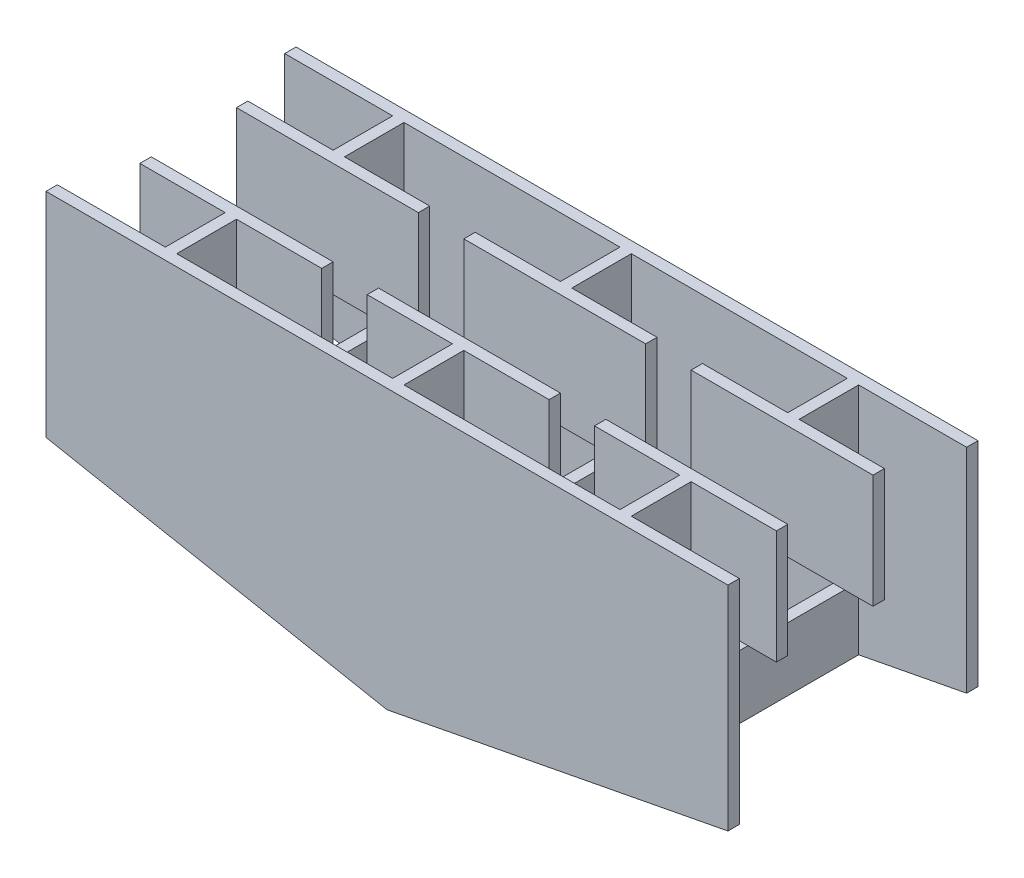
from build123d import *

# Parameters (mm, degrees)
BOSS_EXTRUDE1_DEPTH     = 111.76
SKETCH5_W               = 304.8
SKETCH5_H               = 25.4
CUT_EXTRUDE3_DEPTH      = 101.6
CUT_EXTRUDE4_DEPTH      = 227.288199427
CUT_EXTRUDE4_DEPTH_BACK = 227.288199427
SKETCH3_W               = 96.52
SKETCH3_H               = 101.6
SKETCH3_W_2             = 48.26
CUT_EXTRUDE5_REACH      = 288.663
SKETCH6_W               = 38.1
SKETCH6_H               = 50.8
SKETCH7_W               = 81.28
SKETCH7_H               = 50.8
BOSS_EXTRUDE2_DEPTH     = 5.08


with BuildPart() as part:
    # Sketch1 → Boss-Extrude1 (new body)
    with BuildSketch(Plane.XY):
        Polygon((-152.4, 62.23), (-152.4, -33.02), (0, -62.23), (152.4, -32.976439839), (152.4, 62.23), align=None)
    extrude(amount=-BOSS_EXTRUDE1_DEPTH)

    # Sketch5 → Cut-Extrude3 (cut)
    with BuildSketch(Plane.XY.offset(-5.08)):
        with Locations((0, -1.27)):
            Rectangle(SKETCH5_W, SKETCH5_H)
    extrude(amount=-CUT_EXTRUDE3_DEPTH, mode=Mode.SUBTRACT)

    # Sketch3 → Cut-Extrude4 (cut, two sides: drawn at the far end of the back side and taken through both)
    with BuildSketch(Plane(origin=(0, 62.23, 0), x_dir=(1, 0, 0), z_dir=(0, 1, 0)).offset(-CUT_EXTRUDE4_DEPTH_BACK)):
        with Locations((-50.8, 55.88)):
            Rectangle(SKETCH3_W, SKETCH3_H)
        with Locations((50.8, 55.88)):
            Rectangle(SKETCH3_W, SKETCH3_H)
        with Locations((-128.27, 55.88)):
            Rectangle(SKETCH3_W_2, SKETCH3_H)
        with Locations((128.27, 55.88)):
            Rectangle(SKETCH3_W_2, SKETCH3_H)
    extrude(amount=CUT_EXTRUDE4_DEPTH + CUT_EXTRUDE4_DEPTH_BACK, mode=Mode.SUBTRACT)

    # Cut-Extrude5: up to this face of the body (flat: up to its plane)
    cut_extrude5_end = Plane(part.part.faces().sort_by_distance((104.14, 36.83, -55.88))[0])
    # Sketch6 → Cut-Extrude5 (cut, up to the picked face)
    with BuildSketch(Plane.ZY.offset(104.14), mode=Mode.PRIVATE) as cut_extrude5_sk1:
        with Locations((-55.932057734, 36.83)):
            Rectangle(SKETCH6_W, SKETCH6_H)
    cut_extrude5_tool1 = split(extrude(cut_extrude5_sk1.sketch, amount=-CUT_EXTRUDE5_REACH, mode=Mode.PRIVATE), bisect_by=cut_extrude5_end, keep=Keep.BOTH, mode=Mode.PRIVATE)
    add(cut_extrude5_tool1.solids().sort_by(Axis((-104.14, 36.83, -55.932058), (1, 0, 0)))[0], mode=Mode.SUBTRACT)

    # Sketch7 → Boss-Extrude2 (add)
    with BuildSketch(Plane(origin=(0, 0, -36.882057734), x_dir=(-1, 0, 0), z_dir=(0, 0, -1))):
        with Locations((0, 36.83)):
            Rectangle(SKETCH7_W, SKETCH7_H)
        with Locations((101.6, 36.83)):
            Rectangle(SKETCH7_W, SKETCH7_H)
        with Locations((-101.6, 36.83)):
            Rectangle(SKETCH7_W, SKETCH7_H)
    boss_extrude2 = extrude(amount=-BOSS_EXTRUDE2_DEPTH)

    # Mirror1: Boss-Extrude2 across plane
    add(boss_extrude2.mirror(Plane(origin=(0, 0, -55.932057734), x_dir=(1, 0, 0), z_dir=(0, 0, -1))))


solid = part.part
